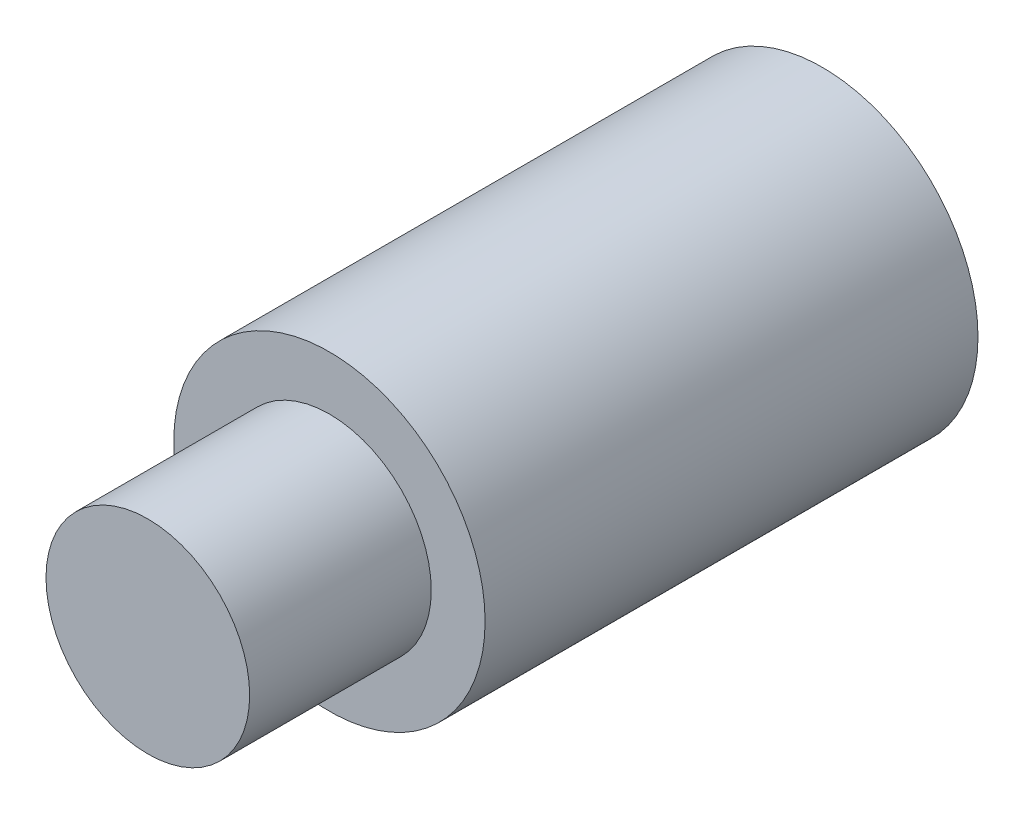
from build123d import *

# Parameters (mm, degrees)
SKIZZE1_R                       = 6
AUFSATZ_LINEAR_AUSTRAGEN1_DEPTH = 19
SKIZZE2_R                       = 3.925
AUFSATZ_LINEAR_AUSTRAGEN2_DEPTH = 7


with BuildPart() as part:
    # Skizze1 → Aufsatz-Linear austragen1 (new body)
    with BuildSketch(Plane.XY):
        Circle(SKIZZE1_R)
    extrude(amount=AUFSATZ_LINEAR_AUSTRAGEN1_DEPTH)

    # Skizze2 → Aufsatz-Linear austragen2 (add)
    with BuildSketch(Plane.XY.offset(19)):
        Circle(SKIZZE2_R)
    extrude(amount=AUFSATZ_LINEAR_AUSTRAGEN2_DEPTH)


solid = part.part
